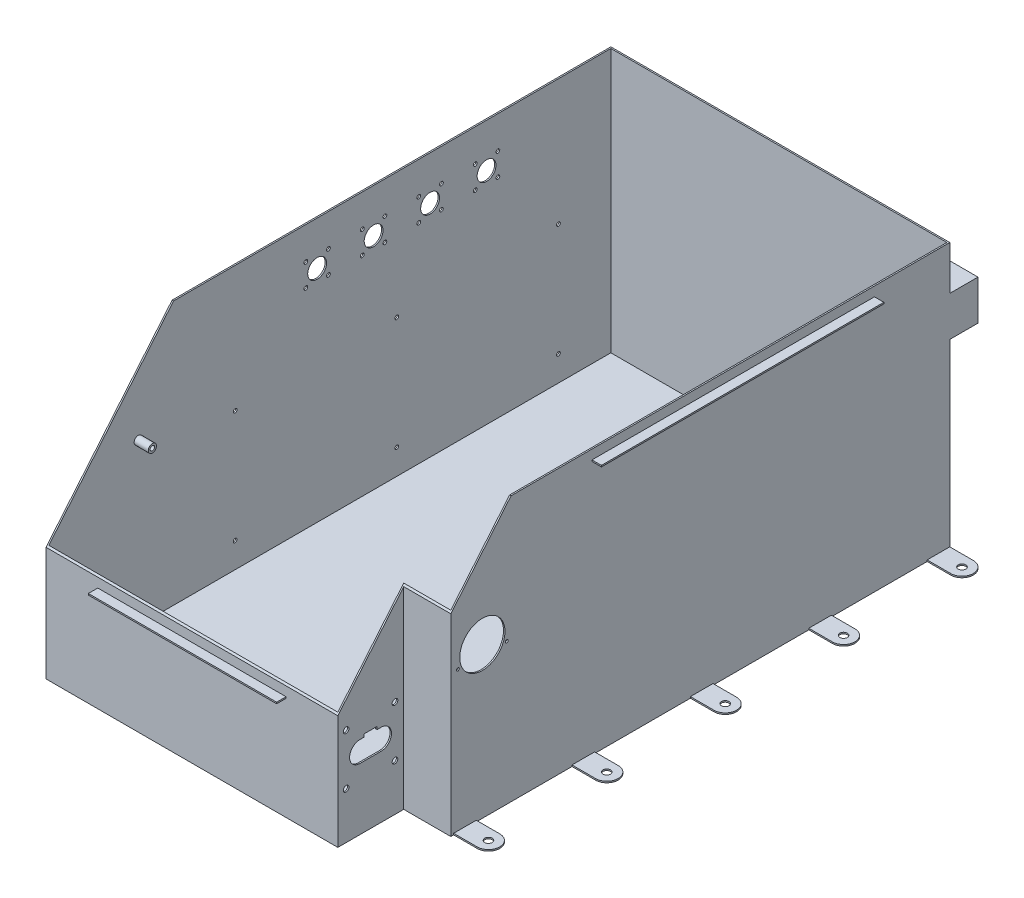
from build123d import *

# Parameters (mm, degrees)
BOSS_EXTRUDE1_DEPTH     = 1.5
BOSS_EXTRUDE2_DEPTH     = 280
SKETCH4_W               = 360
SKETCH4_H               = 42.385541564
BOSS_EXTRUDE3_DEPTH     = 30
CUT_EXTRUDE1_DEPTH      = 584.105512667
CUT_EXTRUDE1_DEPTH_BACK = 584.105512667
SKETCH8_R               = 4.39
SKETCH8_R_2             = 2.39
BOSS_EXTRUDE5_DEPTH     = 15
SKETCH10_R              = 3
CUT_EXTRUDE2_DEPTH      = 1.5
SKETCH15_W              = 15
SKETCH15_H              = 1.5
SKETCH15_W_2            = 20
BOSS_EXTRUDE6_DEPTH     = 13
BOSS_EXTRUDE7_DEPTH     = 1.5
BOSS_EXTRUDE8_DEPTH     = 1.5
SKETCH20_R              = 2.415919743
SKETCH20_R_2            = 2
CUT_EXTRUDE5_DEPTH      = 1.5
SKETCH5_R               = 2
SKETCH5_R_2             = 10
CUT_EXTRUDE7_DEPTH      = 1.5
SKETCH21_W              = 300
SKETCH21_H              = 1.5
BOSS_EXTRUDE9_DEPTH     = 10
SKETCH22_W              = 300
SKETCH22_H              = 1.5
BOSS_EXTRUDE10_DEPTH    = 10
BOSS_EXTRUDE11_DEPTH    = 0.75
BOSS_EXTRUDE12_DEPTH    = 0.75
BOSS_EXTRUDE13_DEPTH    = 0.75
BOSS_EXTRUDE14_DEPTH    = 0.75
SKETCH27_W              = 200
SKETCH27_H              = 1.5
BOSS_EXTRUDE15_DEPTH    = 10
BOSS_EXTRUDE16_DEPTH    = 0.75
BOSS_EXTRUDE17_DEPTH    = 0.75
SKETCH30_R              = 24
SKETCH30_R_2            = 1.5
CUT_EXTRUDE8_DEPTH      = 1.5
SKETCH31_R              = 4
BOSS_EXTRUDE18_DEPTH    = 1.5
BOSS_EXTRUDE18_2_DEPTH  = 1.5
BOSS_EXTRUDE18_3_DEPTH  = 1.5
BOSS_EXTRUDE18_4_DEPTH  = 1.5
BOSS_EXTRUDE18_5_DEPTH  = 1.5
BOSS_EXTRUDE18_6_DEPTH  = 1.5
BOSS_EXTRUDE18_7_DEPTH  = 1.5
BOSS_EXTRUDE18_8_DEPTH  = 1.5
BOSS_EXTRUDE18_9_DEPTH  = 1.5
BOSS_EXTRUDE18_10_DEPTH = 1.5
SKETCH33_R              = 2
CUT_EXTRUDE9_DEPTH      = 1.5


with BuildPart() as part:
    # Sketch1 → Boss-Extrude1 (new body)
    with BuildSketch(Plane(origin=(0, 0, 0), x_dir=(1, 0, 0), z_dir=(0, 1, 0))):
        Polygon((-180, 237.826300096), (180, 237.826300096), (180, -292.173699904), (130, -292.173699904), (130, -362.173699904), (-180, -362.173699904), align=None)
    extrude(amount=BOSS_EXTRUDE1_DEPTH)

    # Sketch2 → Boss-Extrude2 (add)
    with BuildSketch(Plane(origin=(0, 1.5, 0), x_dir=(1, 0, 0), z_dir=(0, 1, 0))):
        Polygon((-180, 237.826300096), (-180, -362.173699904), (130, -362.173699904), (130, -292.173699904), (180, -292.173699904), (180, 237.826300096), align=None)
        Polygon((-178.5, 236.326300096), (-178.5, -360.673699904), (128.5, -360.673699904), (128.5, -290.673699904), (178.5, -290.673699904), (178.5, 236.326300096), align=None, mode=Mode.SUBTRACT)
    extrude(amount=BOSS_EXTRUDE2_DEPTH)

    # Sketch4 → Boss-Extrude3 (add)
    with BuildSketch(Plane(origin=(0, 0, -237.826300096), x_dir=(-1, 0, 0), z_dir=(0, 0, -1))):
        with Locations((0, 213.483316708)):
            Rectangle(SKETCH4_W, SKETCH4_H)
    extrude(amount=BOSS_EXTRUDE3_DEPTH)

    # Sketch3 → Cut-Extrude1 (cut, two sides: drawn at the far end of the back side and taken through both)
    with BuildSketch(Plane.ZY.offset(180).offset(-CUT_EXTRUDE1_DEPTH_BACK)):
        Polygon((362.173699904, 121.117558148), (228.195222706, 281.5), (362.173699904, 281.5), align=None)
    extrude(amount=CUT_EXTRUDE1_DEPTH + CUT_EXTRUDE1_DEPTH_BACK, mode=Mode.SUBTRACT)

    # Sketch8 → Boss-Extrude5 (add)
    # profile 1 of 2: a face of its own
    with BuildSketch(Plane(origin=(-178.5, 0, 0), x_dir=(0, 0, -1), z_dir=(1, 0, 0))):
        with Locations((-265.673699904, 172.2)):
            Circle(SKETCH8_R)
        with Locations((-265.673699904, 172.2)):
            Circle(SKETCH8_R_2, mode=Mode.SUBTRACT)
    # profile 2 of 2: a face of its own
    with BuildSketch(Plane(origin=(-178.5, 0, 0), x_dir=(0, 0, -1), z_dir=(1, 0, 0))):
        with Locations((-265.673699904, 16.5)):
            Circle(SKETCH8_R)
        with Locations((-265.673699904, 16.5)):
            Circle(SKETCH8_R_2, mode=Mode.SUBTRACT)
    extrude(amount=BOSS_EXTRUDE5_DEPTH)

    # Sketch10 → Cut-Extrude2 (cut)
    with BuildSketch(Plane.ZY.offset(-128.5)):
        with BuildLine():
            Line((334.423699904, 90.5), (320.423699904, 90.5))
            Line((320.423699904, 90.5), (320.423699904, 87.5))
            Line((320.423699904, 87.5), (316.173699904, 87.5))
            ThreePointArc((316.173699904, 87.5), (305.173699904, 76.5), (316.173699904, 65.5))
            Line((316.173699904, 65.5), (338.673699904, 65.5))
            ThreePointArc((338.673699904, 65.5), (349.673699904, 76.5), (338.673699904, 87.5))
            Line((338.673699904, 87.5), (334.423699904, 87.5))
            Line((334.423699904, 87.5), (334.423699904, 90.5))
        make_face()
        with Locations((301.473699904, 103.45)):
            Circle(SKETCH10_R)
        with Locations((353.373699904, 103.45)):
            Circle(SKETCH10_R)
        with Locations((301.473699904, 49.55)):
            Circle(SKETCH10_R)
        with Locations((353.373699904, 49.55)):
            Circle(SKETCH10_R)
    extrude(amount=-CUT_EXTRUDE2_DEPTH, mode=Mode.SUBTRACT)

    # Sketch15 → Boss-Extrude6 (add)
    with BuildSketch(Plane.ZY.offset(-178.5)):
        with Locations((-143.826300096, 251.386283415)):
            Rectangle(SKETCH15_W, SKETCH15_H)
        with Locations((136.673699904, 251.386283415)):
            Rectangle(SKETCH15_W_2, SKETCH15_H)
    extrude(amount=BOSS_EXTRUDE6_DEPTH)

    # Sketch17 → Boss-Extrude7 (add)
    with BuildSketch(Plane.XY.offset(-136.326300096)):
        Polygon((178.5, 250.636283415), (178.5, 235.636283415), (165.5, 250.636283415), align=None)
    extrude(amount=-BOSS_EXTRUDE7_DEPTH)

    # Sketch18 → Boss-Extrude8 (add)
    with BuildSketch(Plane.XY.offset(126.673699904)):
        Polygon((178.5, 250.636283415), (178.5, 235.636283415), (165.5, 250.636283415), align=None)
    extrude(amount=BOSS_EXTRUDE8_DEPTH)

    # Sketch20 → Cut-Extrude5 (cut)
    with BuildSketch(Plane(origin=(0, 252.136283415, 0), x_dir=(1, 0, 0), z_dir=(0, 1, 0))):
        with Locations(Location((173, 144.326300096, 0), (0, 0, 270))):
            Circle(SKETCH20_R)
        with Locations(Location((175.5, -139.673699904, 0), (0, 0, 270))):
            Circle(SKETCH20_R_2)
    extrude(amount=-CUT_EXTRUDE5_DEPTH, mode=Mode.SUBTRACT)

    # Sketch5 → Cut-Extrude7 (cut)
    with BuildSketch(Plane.ZY.offset(180)):
        with Locations((-116.326300096, 247.125857706)):
            Circle(SKETCH5_R)
        with Locations((-116.326300096, 223.125857706)):
            Circle(SKETCH5_R)
        with Locations((-92.326300096, 223.125857706)):
            Circle(SKETCH5_R)
        with Locations((-92.326300096, 247.125857706)):
            Circle(SKETCH5_R)
        with Locations((-104.326300096, 235.125857706)):
            Circle(SKETCH5_R_2)
        with Locations((-56.326300096, 247.125857706)):
            Circle(SKETCH5_R)
        with Locations((-56.326300096, 223.125857706)):
            Circle(SKETCH5_R)
        with Locations((-32.326300096, 223.125857706)):
            Circle(SKETCH5_R)
        with Locations((-32.326300096, 247.125857706)):
            Circle(SKETCH5_R)
        with Locations((-44.326300096, 235.125857706)):
            Circle(SKETCH5_R_2)
        with Locations((3.673699904, 247.125857706)):
            Circle(SKETCH5_R)
        with Locations((3.673699904, 223.125857706)):
            Circle(SKETCH5_R)
        with Locations((27.673699904, 223.125857706)):
            Circle(SKETCH5_R)
        with Locations((27.673699904, 247.125857706)):
            Circle(SKETCH5_R)
        with Locations((15.673699904, 235.125857706)):
            Circle(SKETCH5_R_2)
        with Locations((63.673699904, 247.125857706)):
            Circle(SKETCH5_R)
        with Locations((63.673699904, 223.125857706)):
            Circle(SKETCH5_R)
        with Locations((87.673699904, 223.125857706)):
            Circle(SKETCH5_R)
        with Locations((87.673699904, 247.125857706)):
            Circle(SKETCH5_R)
        with Locations((75.673699904, 235.125857706)):
            Circle(SKETCH5_R_2)
    extrude(amount=-CUT_EXTRUDE7_DEPTH, mode=Mode.SUBTRACT)

    # Sketch21 → Boss-Extrude9 (add)
    with BuildSketch(Plane(origin=(0, 0, -237.826300096), x_dir=(-1, 0, 0), z_dir=(0, 0, -1))):
        with Locations((0, 270.75)):
            Rectangle(SKETCH21_W, SKETCH21_H)
    extrude(amount=BOSS_EXTRUDE9_DEPTH)

    # Sketch22 → Boss-Extrude10 (add)
    with BuildSketch(Plane.ZY.offset(180)):
        with Locations((-7.826300096, 270.75)):
            Rectangle(SKETCH22_W, SKETCH22_H)
    boss_extrude10 = extrude(amount=BOSS_EXTRUDE10_DEPTH)

    # Sketch23 → Boss-Extrude11 (add, symmetric)
    with BuildSketch(Plane(origin=(0, 0, -77.826300096), x_dir=(-1, 0, 0), z_dir=(0, 0, -1))):
        Polygon((190, 270), (180, 270), (180, 260), align=None)
    boss_extrude11 = extrude(amount=BOSS_EXTRUDE11_DEPTH, both=True)

    # Sketch24 → Boss-Extrude12 (add, symmetric)
    with BuildSketch(Plane.XY.offset(52.173699904)):
        Polygon((-190, 270), (-180, 260), (-180, 270), align=None)
    boss_extrude12 = extrude(amount=BOSS_EXTRUDE12_DEPTH, both=True)

    # Sketch25 → Boss-Extrude13 (add, symmetric)
    with BuildSketch(Plane(origin=(100, 0, 0), x_dir=(0, 0, -1), z_dir=(1, 0, 0))):
        Polygon((247.826300096, 270), (237.826300096, 270), (237.826300096, 260), align=None)
    extrude(amount=BOSS_EXTRUDE13_DEPTH, both=True)

    # Sketch26 → Boss-Extrude14 (add, symmetric)
    with BuildSketch(Plane.ZY.offset(100)):
        Polygon((-247.826300096, 270), (-237.826300096, 260), (-237.826300096, 270), align=None)
    extrude(amount=BOSS_EXTRUDE14_DEPTH, both=True)

    # Mirror1: Boss-Extrude10, Boss-Extrude11, Boss-Extrude12 across plane
    add(boss_extrude10.mirror(Plane(origin=(0, 0, 0), x_dir=(0, 0, 1), z_dir=(1, 0, 0))))
    add(boss_extrude11.mirror(Plane(origin=(0, 0, 0), x_dir=(0, 0, 1), z_dir=(1, 0, 0))))
    add(boss_extrude12.mirror(Plane(origin=(0, 0, 0), x_dir=(0, 0, 1), z_dir=(1, 0, 0))))

    # Sketch27 → Boss-Extrude15 (add)
    with BuildSketch(Plane.XY.offset(362.173699904)):
        with Locations((-25, 110.367558148)):
            Rectangle(SKETCH27_W, SKETCH27_H)
    extrude(amount=BOSS_EXTRUDE15_DEPTH)

    # Sketch28 → Boss-Extrude16 (add, symmetric)
    with BuildSketch(Plane.ZY.offset(95)):
        Polygon((372.173699904, 109.617558148), (362.173699904, 109.617558148), (362.173699904, 99.617558148), align=None)
    extrude(amount=BOSS_EXTRUDE16_DEPTH, both=True)

    # Sketch29 → Boss-Extrude17 (add, symmetric)
    with BuildSketch(Plane(origin=(45, 0, 0), x_dir=(0, 0, -1), z_dir=(1, 0, 0))):
        Polygon((-372.173699904, 109.617558148), (-362.173699904, 99.617558148), (-362.173699904, 109.617558148), align=None)
    extrude(amount=BOSS_EXTRUDE17_DEPTH, both=True)

    # Sketch30 → Cut-Extrude8 (cut)
    with BuildSketch(Plane(origin=(180, 0, 0), x_dir=(0, 0, -1), z_dir=(1, 0, 0))):
        with Locations((-258.673699904, 160)):
            Circle(SKETCH30_R)
        with Locations((-284.673699904, 150)):
            Circle(SKETCH30_R_2)
        with Locations((-232.673699904, 150)):
            Circle(SKETCH30_R_2)
    extrude(amount=-CUT_EXTRUDE8_DEPTH, mode=Mode.SUBTRACT)

    # Sketch33 → Cut-Extrude9 (cut)
    with BuildSketch(Plane.ZY.offset(180)):
        with Locations((-180.626300096, 147.77)):
            Circle(SKETCH33_R)
        with Locations((-180.626300096, 28.39)):
            Circle(SKETCH33_R)
        with Locations((-8.926300096, 147.77)):
            Circle(SKETCH33_R)
        with Locations((-8.926300096, 28.39)):
            Circle(SKETCH33_R)
        with Locations((162.773699904, 147.77)):
            Circle(SKETCH33_R)
        with Locations((162.773699904, 28.39)):
            Circle(SKETCH33_R)
    extrude(amount=-CUT_EXTRUDE9_DEPTH, mode=Mode.SUBTRACT)


with BuildPart() as body_2:
    # Sketch31 → Boss-Extrude18 (new body)
    with BuildSketch(Plane.XZ):
        with BuildLine():
            Line((205, -213.826300096), (180, -213.826300096))
            Line((180, -213.826300096), (180, -237.826300096))
            Line((180, -237.826300096), (205, -237.826300096))
            ThreePointArc((205, -237.826300096), (217, -225.826300096), (205, -213.826300096))
        make_face()
        with Locations(Location((205, -225.826300096, 0), (0, 0, 270))):
            Circle(SKETCH31_R, mode=Mode.SUBTRACT)
    extrude(amount=-BOSS_EXTRUDE18_DEPTH)


with BuildPart() as body_3:
    # Sketch31 → Boss-Extrude18 2 (new body)
    with BuildSketch(Plane.XZ):
        with BuildLine():
            Line((205, -88.076300096), (180, -88.076300096))
            Line((180, -88.076300096), (180, -112.076300096))
            Line((180, -112.076300096), (205, -112.076300096))
            ThreePointArc((205, -112.076300096), (217, -100.076300096), (205, -88.076300096))
        make_face()
        with Locations(Location((205, -100.076300096, 0), (0, 0, 270))):
            Circle(SKETCH31_R, mode=Mode.SUBTRACT)
    extrude(amount=-BOSS_EXTRUDE18_2_DEPTH)


with BuildPart() as body_4:
    # Sketch31 → Boss-Extrude18 3 (new body)
    with BuildSketch(Plane.XZ):
        with BuildLine():
            Line((205, 37.673699904), (180, 37.673699904))
            Line((180, 37.673699904), (180, 13.673699904))
            Line((180, 13.673699904), (205, 13.673699904))
            ThreePointArc((205, 13.673699904), (217, 25.673699904), (205, 37.673699904))
        make_face()
        with Locations(Location((205, 25.673699904, 0), (0, 0, 270))):
            Circle(SKETCH31_R, mode=Mode.SUBTRACT)
    extrude(amount=-BOSS_EXTRUDE18_3_DEPTH)


with BuildPart() as body_5:
    # Sketch31 → Boss-Extrude18 4 (new body)
    with BuildSketch(Plane.XZ):
        with BuildLine():
            Line((205, 163.423699904), (180, 163.423699904))
            Line((180, 163.423699904), (180, 139.423699904))
            Line((180, 139.423699904), (205, 139.423699904))
            ThreePointArc((205, 139.423699904), (217, 151.423699904), (205, 163.423699904))
        make_face()
        with Locations(Location((205, 151.423699904, 0), (0, 0, 270))):
            Circle(SKETCH31_R, mode=Mode.SUBTRACT)
    extrude(amount=-BOSS_EXTRUDE18_4_DEPTH)


with BuildPart() as body_6:
    # Sketch31 → Boss-Extrude18 5 (new body)
    with BuildSketch(Plane.XZ):
        with BuildLine():
            Line((205, 289.173699904), (180, 289.173699904))
            Line((180, 289.173699904), (180, 265.173699904))
            Line((180, 265.173699904), (205, 265.173699904))
            ThreePointArc((205, 265.173699904), (217, 277.173699904), (205, 289.173699904))
        make_face()
        with Locations(Location((205, 277.173699904, 0), (0, 0, 270))):
            Circle(SKETCH31_R, mode=Mode.SUBTRACT)
    extrude(amount=-BOSS_EXTRUDE18_5_DEPTH)


with BuildPart() as body_7:
    # Sketch31 → Boss-Extrude18 6 (new body)
    with BuildSketch(Plane.XZ):
        with BuildLine():
            ThreePointArc((-205, 163.423699904), (-217, 151.423699904), (-205, 139.423699904))
            Line((-205, 139.423699904), (-180, 139.423699904))
            Line((-180, 139.423699904), (-180, 163.423699904))
            Line((-180, 163.423699904), (-205, 163.423699904))
        make_face()
        with Locations(Location((-205, 151.423699904, 0), (0, 0, 270))):
            Circle(SKETCH31_R, mode=Mode.SUBTRACT)
    extrude(amount=-BOSS_EXTRUDE18_6_DEPTH)


with BuildPart() as body_8:
    # Sketch31 → Boss-Extrude18 7 (new body)
    with BuildSketch(Plane.XZ):
        with BuildLine():
            ThreePointArc((-205, -213.826300096), (-217, -225.826300096), (-205, -237.826300096))
            Line((-205, -237.826300096), (-180, -237.826300096))
            Line((-180, -237.826300096), (-180, -213.826300096))
            Line((-180, -213.826300096), (-205, -213.826300096))
        make_face()
        with Locations(Location((-205, -225.826300096, 0), (0, 0, 270))):
            Circle(SKETCH31_R, mode=Mode.SUBTRACT)
    extrude(amount=-BOSS_EXTRUDE18_7_DEPTH)


with BuildPart() as body_9:
    # Sketch31 → Boss-Extrude18 8 (new body)
    with BuildSketch(Plane.XZ):
        with BuildLine():
            Line((-205, -112.076300096), (-180, -112.076300096))
            Line((-180, -112.076300096), (-180, -88.076300096))
            Line((-180, -88.076300096), (-205, -88.076300096))
            ThreePointArc((-205, -88.076300096), (-217, -100.076300096), (-205, -112.076300096))
        make_face()
        with Locations(Location((-205, -100.076300096, 0), (0, 0, 270))):
            Circle(SKETCH31_R, mode=Mode.SUBTRACT)
    extrude(amount=-BOSS_EXTRUDE18_8_DEPTH)


with BuildPart() as body_10:
    # Sketch31 → Boss-Extrude18 9 (new body)
    with BuildSketch(Plane.XZ):
        with BuildLine():
            Line((-205, 265.173699904), (-180, 265.173699904))
            Line((-180, 265.173699904), (-180, 289.173699904))
            Line((-180, 289.173699904), (-205, 289.173699904))
            ThreePointArc((-205, 289.173699904), (-217, 277.173699904), (-205, 265.173699904))
        make_face()
        with Locations(Location((-205, 277.173699904, 0), (0, 0, 270))):
            Circle(SKETCH31_R, mode=Mode.SUBTRACT)
    extrude(amount=-BOSS_EXTRUDE18_9_DEPTH)


with BuildPart() as body_11:
    # Sketch31 → Boss-Extrude18 10 (new body)
    with BuildSketch(Plane.XZ):
        with BuildLine():
            Line((-205, 13.673699904), (-180, 13.673699904))
            Line((-180, 13.673699904), (-180, 37.673699904))
            Line((-180, 37.673699904), (-205, 37.673699904))
            ThreePointArc((-205, 37.673699904), (-217, 25.673699904), (-205, 13.673699904))
        make_face()
        with Locations(Location((-205, 25.673699904, 0), (0, 0, 270))):
            Circle(SKETCH31_R, mode=Mode.SUBTRACT)
    extrude(amount=-BOSS_EXTRUDE18_10_DEPTH)


solid = Compound([part.part, body_2.part, body_3.part, body_4.part, body_5.part, body_6.part, body_7.part, body_8.part, body_9.part, body_10.part, body_11.part])
